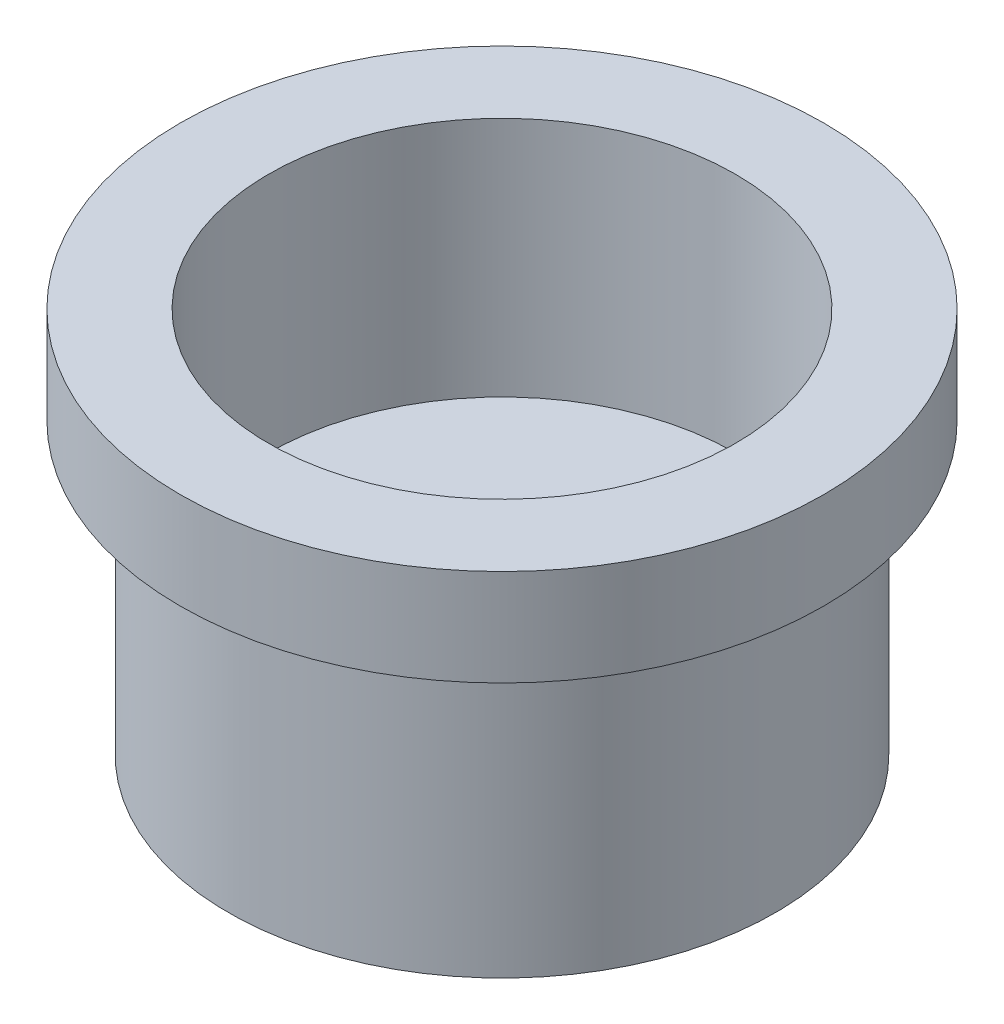
from build123d import *


with BuildPart() as part:
    # 草图1 → 旋转1 (revolve)
    with BuildSketch(Plane.XY, mode=Mode.PRIVATE) as revolve_1_sk:
        Polygon((-2.5, 0), (-2.5, 11), (-4.75, 11), (-4.75, 15), (-14.5, 15), (-14.5, 30), (-20, 30), (-20, 24), (-17, 24), (-17, 6), (-6.5, 6), (-6.5, 5), (-4.5, 5), (-4.5, 0), align=None)
    revolve(revolve_1_sk.sketch.rotate(Axis((0, 0, 0), (0, 1, 0)), 270), axis=Axis((0, 0, 0), (0, 1, 0)))


solid = part.part
